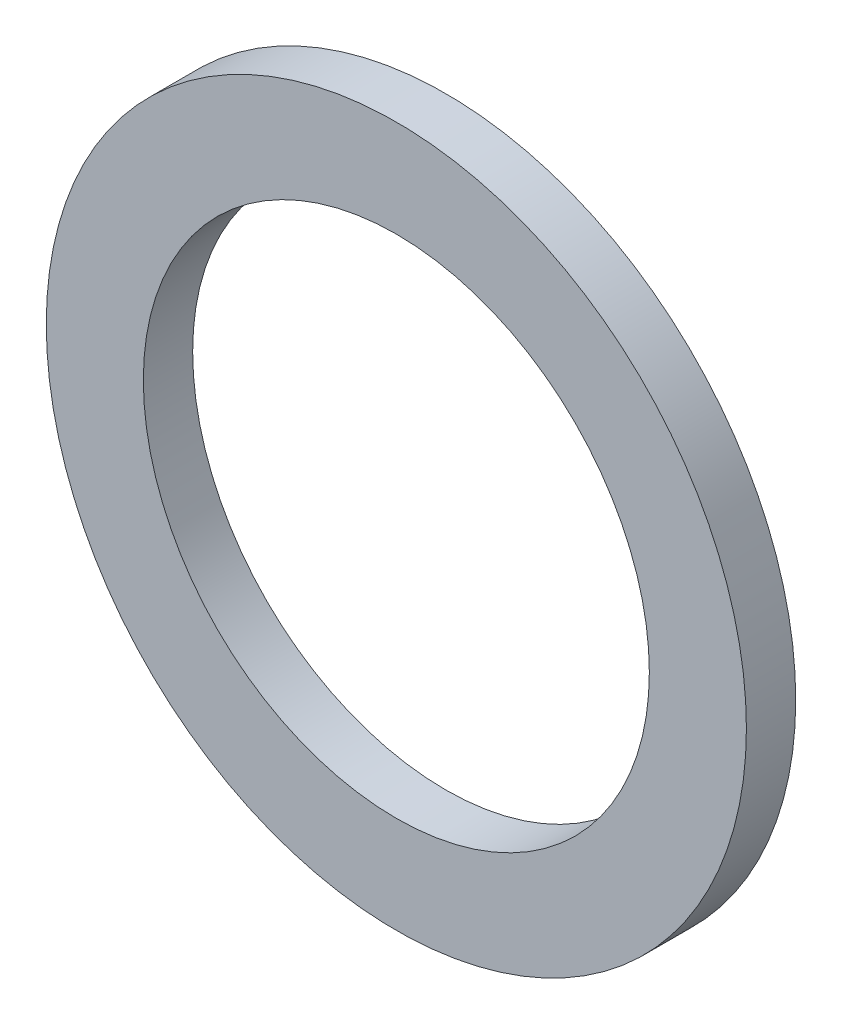
from build123d import *

# Parameters (mm, degrees)
SKETCH1_R      = 5.588
SKETCH1_R_2    = 4.0386
EXTRUDE1_DEPTH = 0.7874


with BuildPart() as part:
    # Sketch1 → Extrude1 (new body)
    with BuildSketch(Plane.XY):
        Circle(SKETCH1_R)
        Circle(SKETCH1_R_2, mode=Mode.SUBTRACT)
    extrude(amount=EXTRUDE1_DEPTH)


solid = part.part
